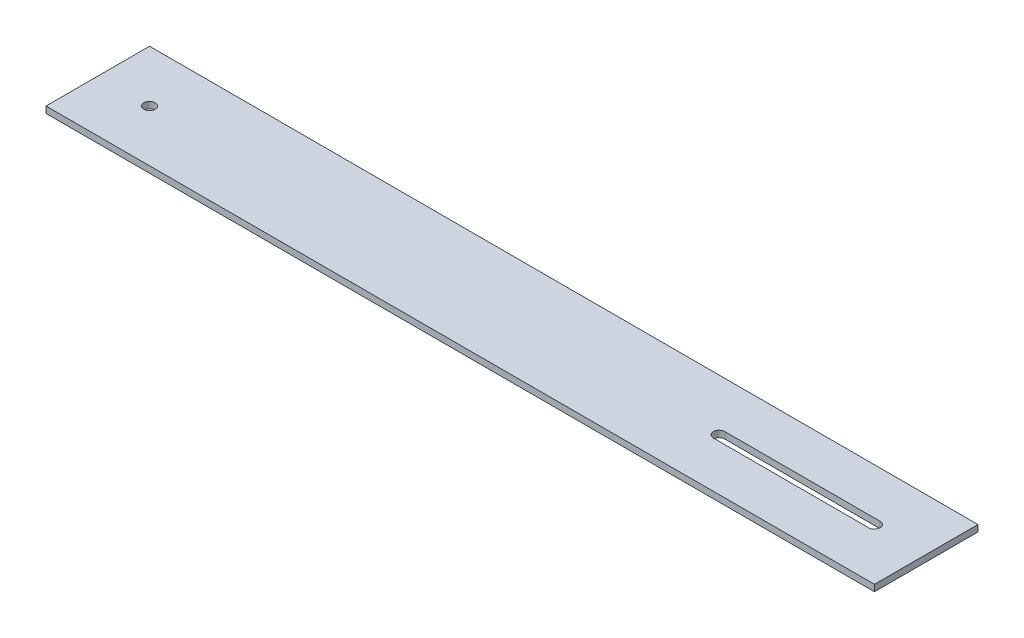
from build123d import *

# Parameters (mm, degrees)
SKETCH1_W           = 406.4
SKETCH1_H           = 50.8
SKETCH1_R           = 2.778125
BOSS_EXTRUDE1_DEPTH = 3.175


with BuildPart() as part:
    # Sketch1 → Boss-Extrude1 (new body)
    with BuildSketch(Plane(origin=(0, 0, 0), x_dir=(1, 0, 0), z_dir=(0, 1, 0))):
        with Locations((203.2, 25.4)):
            Rectangle(SKETCH1_W, SKETCH1_H)
        with Locations(Location((25.4, 25.4, 0), (0, 0, 270))):
            Circle(SKETCH1_R, mode=Mode.SUBTRACT)
        with BuildLine():
            Line((304.8, 28.178125), (381, 28.178125))
            ThreePointArc((381, 28.178125), (383.778125, 25.4), (381, 22.621875))
            Line((381, 22.621875), (304.8, 22.621875))
            ThreePointArc((304.8, 22.621875), (302.021875, 25.4), (304.8, 28.178125))
        make_face(mode=Mode.SUBTRACT)
    extrude(amount=BOSS_EXTRUDE1_DEPTH)


solid = part.part
